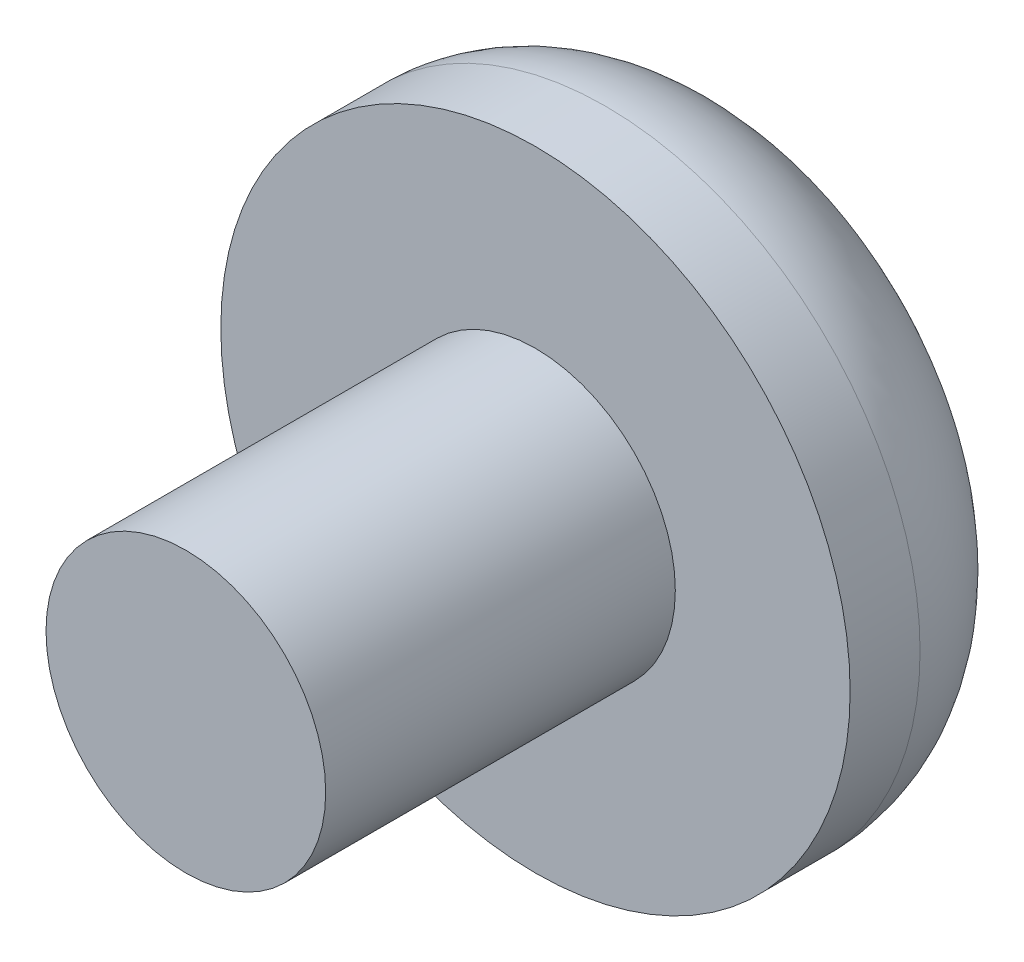
from build123d import *

# Parameters (mm, degrees)
ESQUISSE1_R        = 2
BOSS_EXTRU_1_DEPTH = 5
ESQUISSE2_R        = 4.5
BOSS_EXTRU_2_DEPTH = 3
CONG_1_R           = 2


with BuildPart() as part:
    # Esquisse1 → Boss.-Extru.1 (new body)
    with BuildSketch(Plane.XY):
        Circle(ESQUISSE1_R)
    extrude(amount=BOSS_EXTRU_1_DEPTH)

    # Esquisse2 → Boss.-Extru.2 (add)
    with BuildSketch(Plane.XY):
        Circle(ESQUISSE2_R)
        Polygon((-1.718731116, -0.115769453), (-1.718731116, 0.115769453), (-0.115769453, 0.115769453), (-0.115769453, 1.718731116), (0.115769453, 1.718731116), (0.115769453, 0.115769453), (1.718731116, 0.115769453), (1.718731116, -0.115769453), (0.115769453, -0.115769453), (0.115769453, -1.718731116), (-0.115769453, -1.718731116), (-0.115769453, -0.115769453), align=None, mode=Mode.SUBTRACT)
    extrude(amount=-BOSS_EXTRU_2_DEPTH)

    # Congé1
    cong_1_edges = [part.edges().sort_by_distance(p)[0] for p in [
        (-4.5, 0, -3),
    ]]
    fillet(cong_1_edges, radius=CONG_1_R)


solid = part.part
